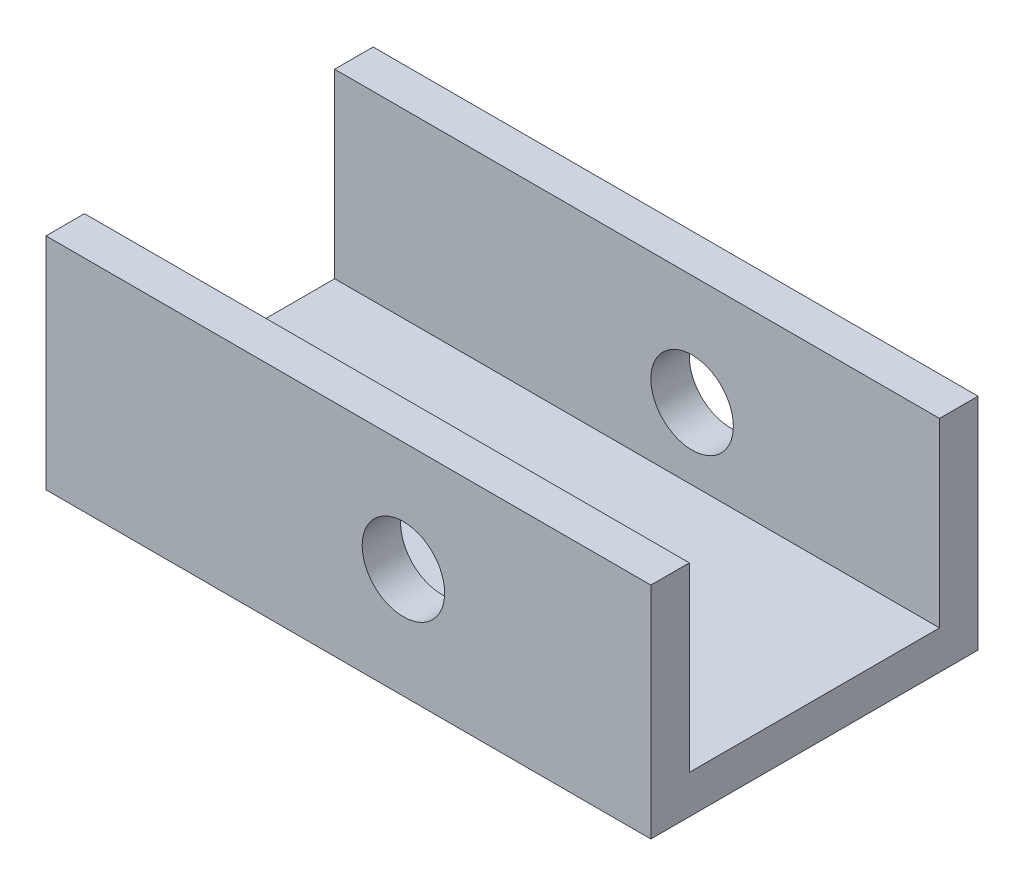
from build123d import *

# Parameters (mm, degrees)
SKETCH_1_W               = 22
SKETCH_1_H               = 11.9
BOTTOM_DEPTH             = 1.4
SKETCH_1_3_W             = 22
SKETCH_1_3_H             = 1.4
EXTRUDE_2_DEPTH          = 8
CUT_EXTRUDE_1_DEPTH      = 27.260426501
CUT_EXTRUDE_1_DEPTH_BACK = 27.260426501
SKETCH_2_R               = 1.5


with BuildPart() as part:
    # Эскиз1 → Bottom (new body)
    with BuildSketch(Plane(origin=(0, 0, 0), x_dir=(1, 0, 0), z_dir=(0, 1, 0))):
        with Locations((11, 5.95)):
            Rectangle(SKETCH_1_W, SKETCH_1_H)
    extrude(amount=BOTTOM_DEPTH)

    # Эскиз1<3> → Бобышка-Вытянуть2 (add)
    with BuildSketch(Plane(origin=(0, 0, 0), x_dir=(1, 0, 0), z_dir=(0, 1, 0))):
        with Locations((11, 11.2)):
            Rectangle(SKETCH_1_3_W, SKETCH_1_3_H)
        with Locations((11, 0.7)):
            Rectangle(SKETCH_1_3_W, SKETCH_1_3_H)
    extrude(amount=EXTRUDE_2_DEPTH)

    # Эскиз2 → Вырез-Вытянуть1 (cut, two sides: drawn at the far end of the back side and taken through both)
    with BuildSketch(Plane.XY.offset(-CUT_EXTRUDE_1_DEPTH_BACK)):
        with Locations((13, 4)):
            Circle(SKETCH_2_R)
    extrude(amount=CUT_EXTRUDE_1_DEPTH + CUT_EXTRUDE_1_DEPTH_BACK, mode=Mode.SUBTRACT)


solid = part.part
